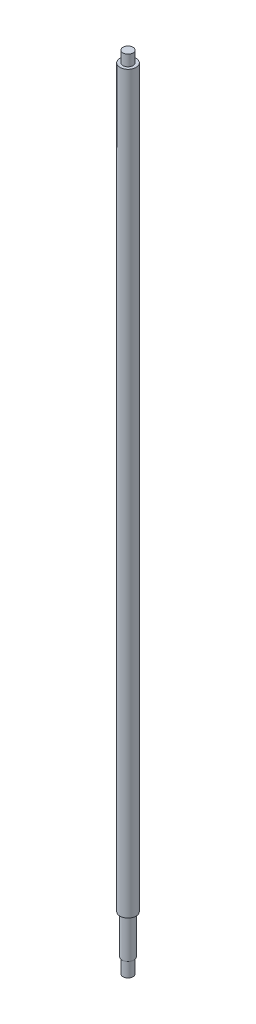
from build123d import *


with BuildPart() as part:
    # Sketch1 → Revolve1 (revolve)
    with BuildSketch(Plane.XY, mode=Mode.PRIVATE) as revolve1_sk:
        Polygon((0, 0), (5, 0), (5, 15), (6, 15), (6, 54), (8, 54), (8, 789), (5, 789), (5, 800), (0, 800), align=None)
    revolve(revolve1_sk.sketch.rotate(Axis((0, 0, 0), (0, 1, 0)), 90), axis=Axis((0, 0, 0), (0, 1, 0)))


solid = part.part
